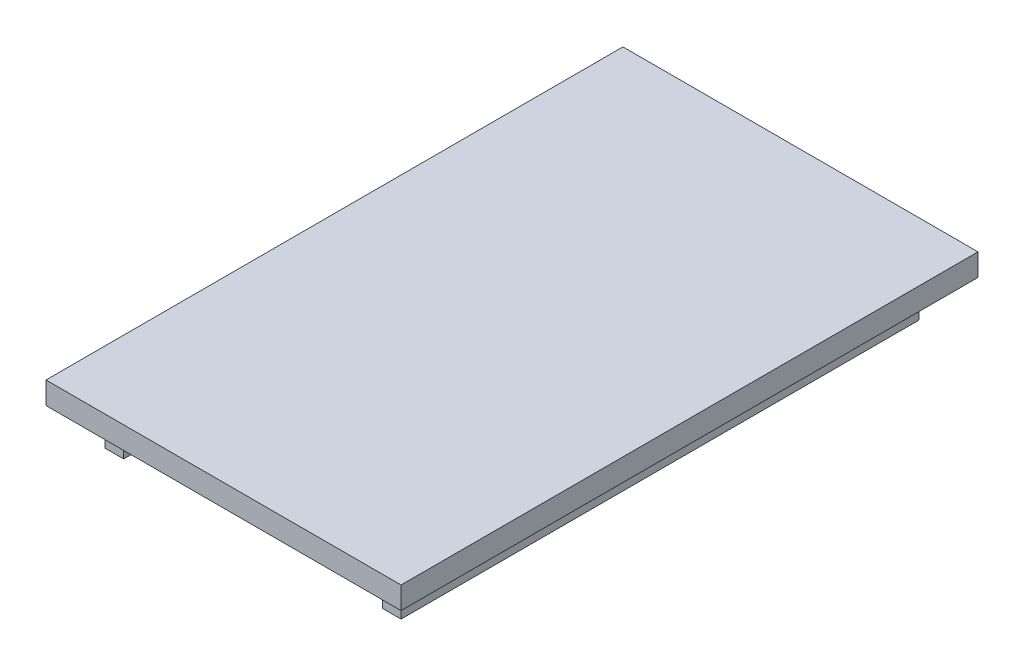
from build123d import *

# Parameters (mm, degrees)
CROQUIS1_W              = 40
CROQUIS1_H              = 70
SALIENTE_EXTRUIR1_DEPTH = 5
CROQUIS3_W              = 48
CROQUIS3_H              = 78
SALIENTE_EXTRUIR3_DEPTH = 3
CROQUIS5_W              = 35
CROQUIS5_H              = 70
CORTAR_EXTRUIR1_DEPTH   = 5


with BuildPart() as part:
    # Croquis1 → Saliente-Extruir1 (new body)
    with BuildSketch(Plane(origin=(0, 0, 0), x_dir=(1, 0, 0), z_dir=(0, 1, 0))):
        with Locations((-20, -35)):
            Rectangle(CROQUIS1_W, CROQUIS1_H)
    extrude(amount=SALIENTE_EXTRUIR1_DEPTH)

    # Croquis3 → Saliente-Extruir3 (add)
    with BuildSketch(Plane(origin=(0, 5, 0), x_dir=(1, 0, 0), z_dir=(0, 1, 0))):
        with Locations((-20, -35)):
            Rectangle(CROQUIS3_W, CROQUIS3_H)
    extrude(amount=SALIENTE_EXTRUIR3_DEPTH)

    # Croquis5 → Cortar-Extruir1 (cut)
    with BuildSketch(Plane.XZ):
        with Locations((-20, 35)):
            Rectangle(CROQUIS5_W, CROQUIS5_H)
    extrude(amount=-CORTAR_EXTRUIR1_DEPTH, mode=Mode.SUBTRACT)


solid = part.part
